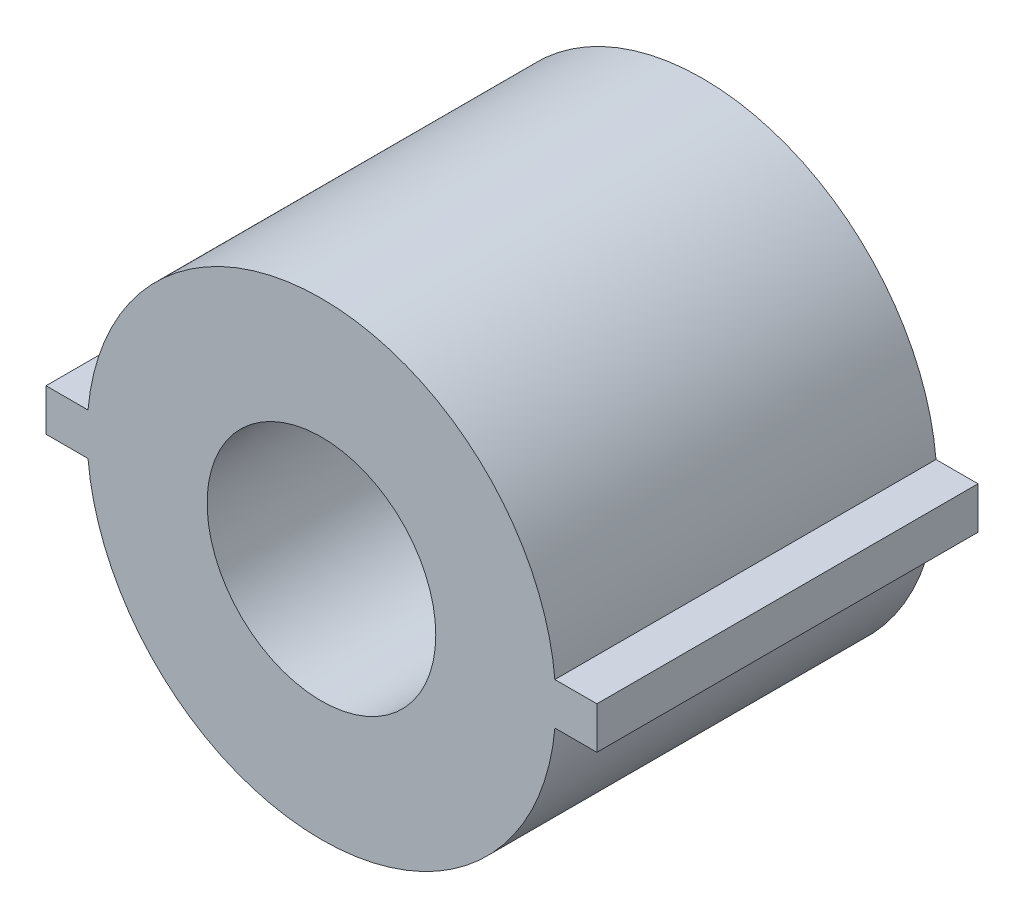
from build123d import *

# Parameters (mm, degrees)
SKETCH1_R           = 3.905
SKETCH1_R_2         = 1.905
BOSS_EXTRUDE1_DEPTH = 6.35
SKETCH2_W           = 0.7
SKETCH2_H           = 0.7
BOSS_EXTRUDE2_DEPTH = 6.35


with BuildPart() as part:
    # Sketch1 → Boss-Extrude1 (new body)
    with BuildSketch(Plane.XY):
        Circle(SKETCH1_R)
        Circle(SKETCH1_R_2, mode=Mode.SUBTRACT)
    extrude(amount=BOSS_EXTRUDE1_DEPTH)

    # Sketch2 → Boss-Extrude2 (add)
    with BuildSketch(Plane(origin=(0, 0, 0), x_dir=(-1, 0, 0), z_dir=(0, 0, -1))):
        with Locations((4.239283353, 0)):
            Rectangle(SKETCH2_W, SKETCH2_H)
        with Locations((-4.239283353, 0)):
            Rectangle(SKETCH2_W, SKETCH2_H)
    extrude(amount=-BOSS_EXTRUDE2_DEPTH)


solid = part.part
